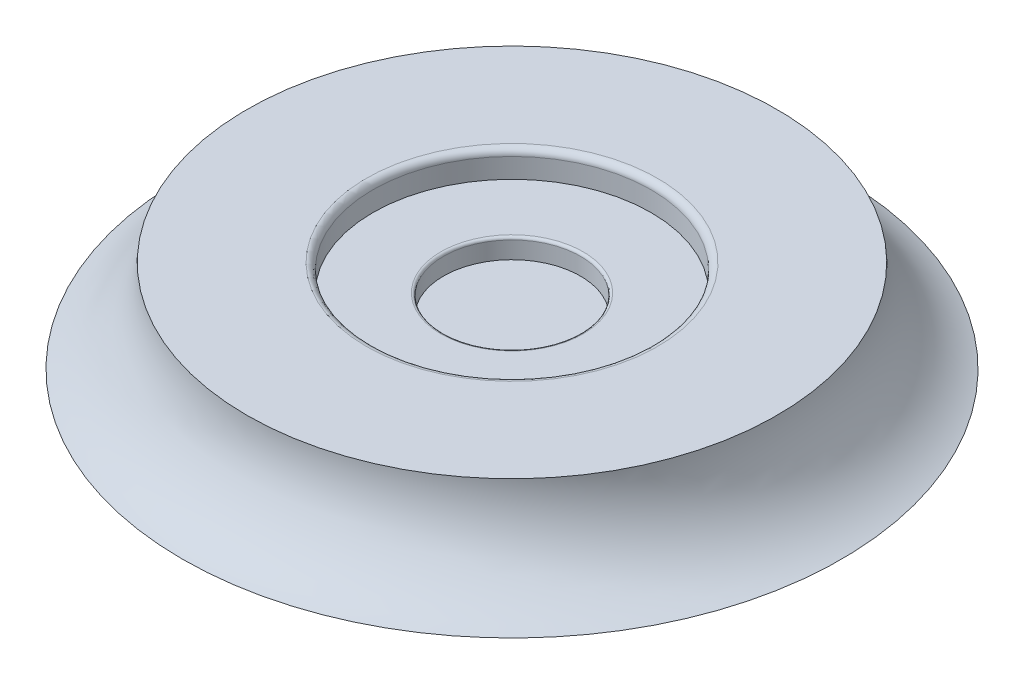
from build123d import *

# Parameters (mm, degrees)
FILLET1_R          = 0.5
SKETCH2_R          = 5.2
CUT_EXTRUDE1_DEPTH = 1.5
FILLET2_R          = 0.2


with BuildPart() as part:
    # Sketch1 → Revolve1 (revolve)
    with BuildSketch(Plane(origin=(0, 0, 0), x_dir=(0, 0, -1), z_dir=(1, 0, 0))):
        with BuildLine():
            Line((0, 0), (-25, 0))
            ThreePointArc((-25, 0), (-21.448462457, 2.728434409), (-20.102542457, 7))
            Line((-20.102542457, 7), (-10.55, 7))
            Line((-10.55, 7), (-10.55, 5))
            Line((-10.55, 5), (0, 5))
            Line((0, 5), (0, 0))
        make_face()
    revolve(axis=Axis((0, 5, 0), (0, -1, 0)))

    # Fillet1
    fillet1_edges = [part.edges().sort_by_distance(p)[0] for p in [
        (0, 7, -10.55),
    ]]
    fillet(fillet1_edges, radius=FILLET1_R)

    # Sketch2 → Cut-Extrude1 (cut)
    with BuildSketch(Plane(origin=(0, 5, 0), x_dir=(1, 0, 0), z_dir=(0, 1, 0))):
        with Locations(Location((0, 0, 0), (0, 0, 270))):
            Circle(SKETCH2_R)
    extrude(amount=-CUT_EXTRUDE1_DEPTH, mode=Mode.SUBTRACT)

    # Fillet2
    fillet2_edges = [part.edges().sort_by_distance(p)[0] for p in [
        (0, 5, -5.2),
    ]]
    fillet(fillet2_edges, radius=FILLET2_R)


solid = part.part
